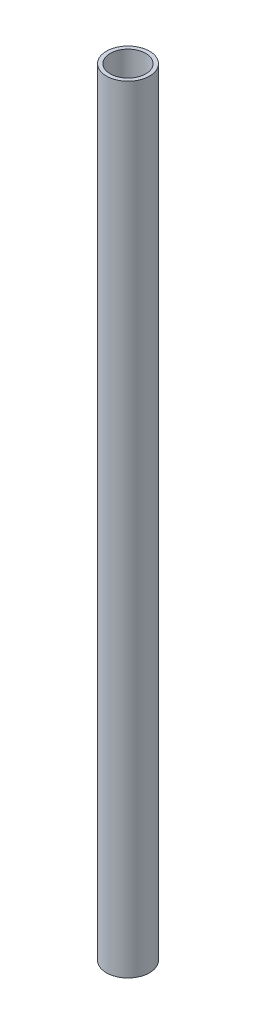
from build123d import *

# Parameters (mm, degrees)
SKETCH1_R           = 12.7
SKETCH1_R_2         = 10.4648
BOSS_EXTRUDE1_DEPTH = 457.2


with BuildPart() as part:
    # Sketch1 → Boss-Extrude1 (new body)
    with BuildSketch(Plane(origin=(0, 0, 0), x_dir=(1, 0, 0), z_dir=(0, 1, 0))):
        with Locations(Location((0, 0, 0), (0, 0, 270))):
            Circle(SKETCH1_R)
        with Locations(Location((0, 0, 0), (0, 0, 270))):
            Circle(SKETCH1_R_2, mode=Mode.SUBTRACT)
    extrude(amount=BOSS_EXTRUDE1_DEPTH)


solid = part.part
